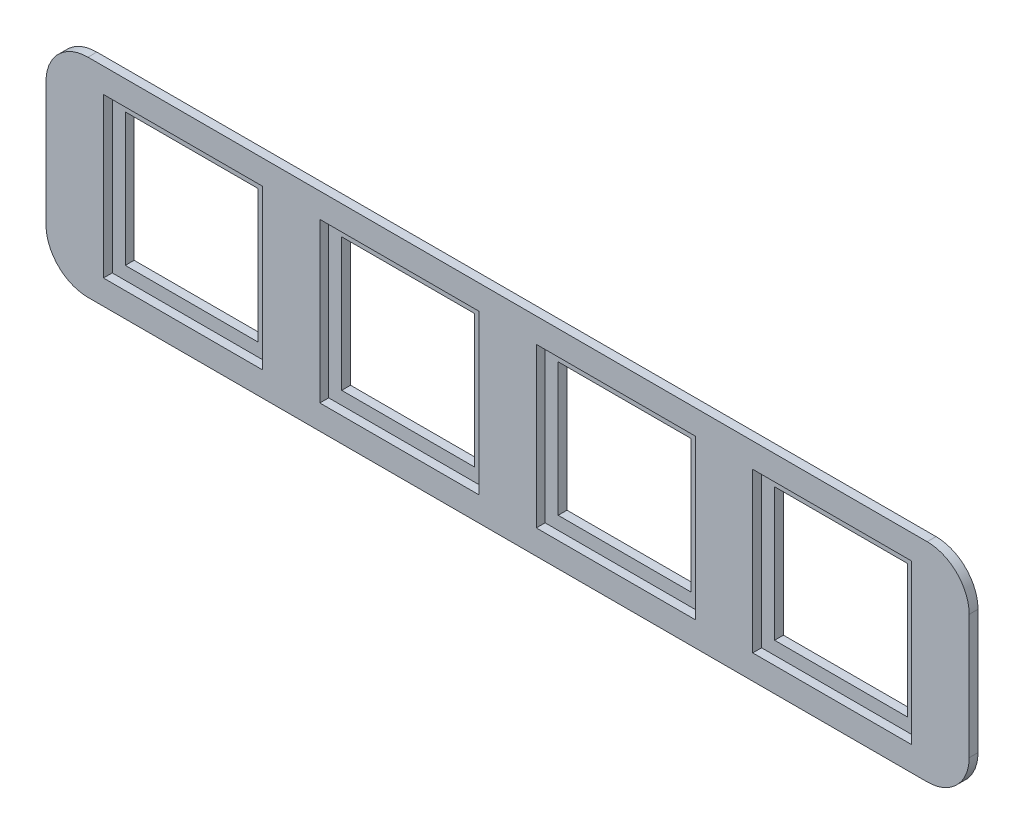
from build123d import *

# Parameters (mm, degrees)
BOSS_EXTRU_1_DEPTH      = 2
BOSS_EXTRU_3_DEPTH      = 2
ESQUISSE7_W             = 36
ESQUISSE7_H             = 36
ENL_V_MAT_EXTRU_4_DEPTH = 2
ESQUISSE8_W             = 30.1
ESQUISSE8_H             = 30.1
ENL_V_MAT_EXTRU_5_DEPTH = 108.195394024


with BuildPart() as part:
    # Esquisse1 → Boss.-Extru.1 (new body)
    with BuildSketch(Plane.XY):
        with BuildLine():
            Line((-95, -23.55), (95, -23.55))
            ThreePointArc((95, -23.55), (101.717514421, -20.767514421), (104.5, -14.05))
            Line((104.5, -14.05), (104.5, 14.05))
            ThreePointArc((104.5, 14.05), (101.717514421, 20.767514421), (95, 23.55))
            Line((95, 23.55), (-95, 23.55))
            ThreePointArc((-95, 23.55), (-101.717514421, 20.767514421), (-104.5, 14.05))
            Line((-104.5, 14.05), (-104.5, -14.05))
            ThreePointArc((-104.5, -14.05), (-101.717514421, -20.767514421), (-95, -23.55))
        make_face()
    extrude(amount=BOSS_EXTRU_1_DEPTH)

    # Esquisse6 → Boss.-Extru.3 (add)
    with BuildSketch(Plane(origin=(0, 0, 0), x_dir=(-1, 0, 0), z_dir=(0, 0, -1))):
        with BuildLine():
            Line((-95, -19.05), (95, -19.05))
            ThreePointArc((95, -19.05), (98.535533906, -17.585533906), (100, -14.05))
            Line((100, -14.05), (100, 14.05))
            ThreePointArc((100, 14.05), (98.535533906, 17.585533906), (95, 19.05))
            Line((95, 19.05), (-95, 19.05))
            ThreePointArc((-95, 19.05), (-98.535533906, 17.585533906), (-100, 14.05))
            Line((-100, 14.05), (-100, -14.05))
            ThreePointArc((-100, -14.05), (-98.535533906, -17.585533906), (-95, -19.05))
        make_face()
    extrude(amount=BOSS_EXTRU_3_DEPTH)

    # Esquisse7 → Enlèv. mat.-Extru.4 (cut)
    with BuildSketch(Plane.XY.offset(2)):
        with Locations((-73.5, 0)):
            Rectangle(ESQUISSE7_W, ESQUISSE7_H)
        with Locations((-24.5, 0)):
            Rectangle(ESQUISSE7_W, ESQUISSE7_H)
        with Locations((24.5, 0)):
            Rectangle(ESQUISSE7_W, ESQUISSE7_H)
        with Locations((73.5, 0)):
            Rectangle(ESQUISSE7_W, ESQUISSE7_H)
    extrude(amount=-ENL_V_MAT_EXTRU_4_DEPTH, mode=Mode.SUBTRACT)

    # Esquisse8 → Enlèv. mat.-Extru.5 (cut, through all)
    with BuildSketch(Plane(origin=(0, 0, -2), x_dir=(-1, 0, 0), z_dir=(0, 0, -1))):
        with Locations((-73.5, 0)):
            Rectangle(ESQUISSE8_W, ESQUISSE8_H)
        with Locations((-24.5, 0)):
            Rectangle(ESQUISSE8_W, ESQUISSE8_H)
        with Locations((24.5, 0)):
            Rectangle(ESQUISSE8_W, ESQUISSE8_H)
        with Locations((73.5, 0)):
            Rectangle(ESQUISSE8_W, ESQUISSE8_H)
    extrude(amount=-ENL_V_MAT_EXTRU_5_DEPTH, mode=Mode.SUBTRACT)


solid = part.part
